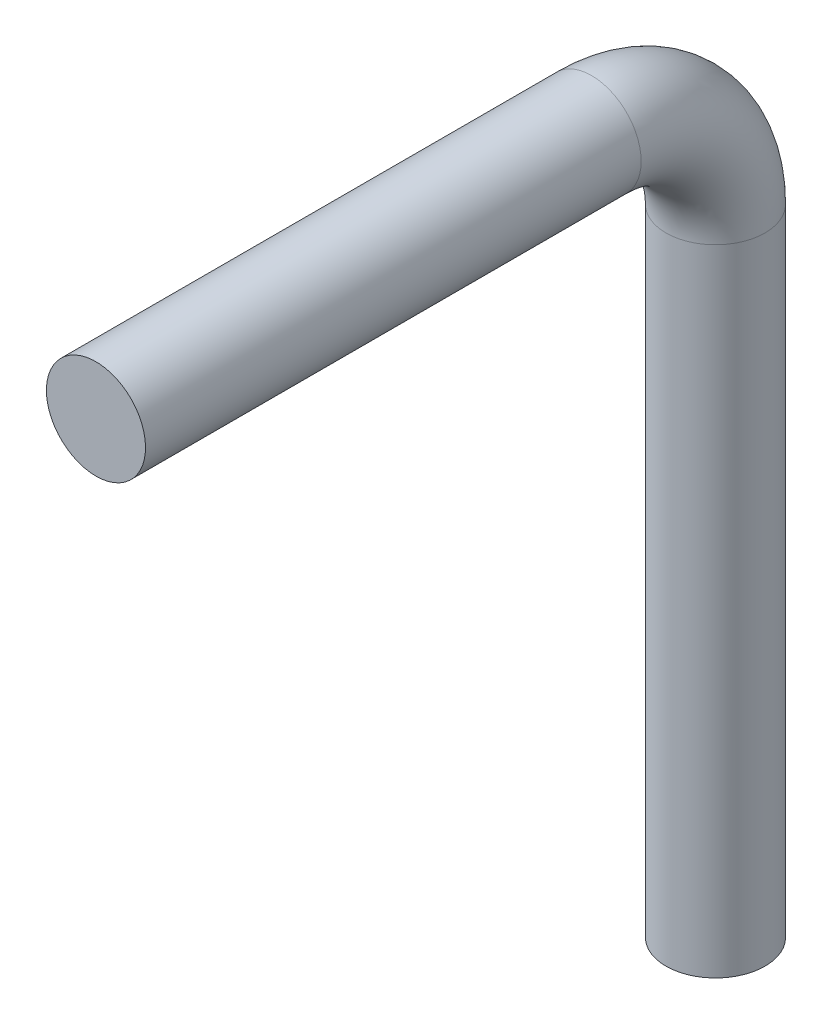
from build123d import *

# Parameters (mm, degrees)
SKETCH1_R = 5.08


with BuildPart() as part:
    # Sweep1: sweep along a path in Sketch2
    with BuildLine(Plane(origin=(0, 0, 0), x_dir=(0, 0, -1), z_dir=(1, 0, 0))) as sweep1_path:
        Line((0, 0), (0, 65.0875))
        ThreePointArc((0, 65.0875), (-3.719743879, 74.067756121), (-12.7, 77.7875))
        Line((-12.7, 77.7875), (-63.5, 77.7875))
    # Sketch1 → Sweep1 (sweep)
    with BuildSketch(Plane(origin=(0, 0, 0), x_dir=(1, 0, 0), z_dir=(0, 1, 0))):
        Circle(SKETCH1_R)
    sweep(path=sweep1_path.line)


solid = part.part
